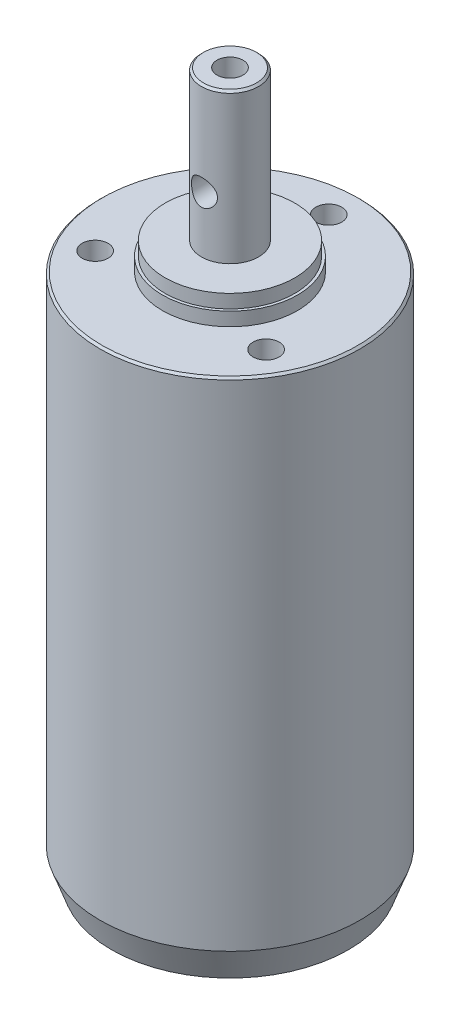
from build123d import *

# Parameters (mm, degrees)
CHAMFER_1_SIZE         = 0.2
CHAMFER_2_SIZE         = 3
CHAMFER_2_SIZE2        = 1.091910703
HOLE_WIZARD_M3_1_D     = 2.5
HOLE_WIZARD_M3_1_DEPTH = 5.5
HOLE_WIZARD_M3_1_TIP   = 0.751075774
HOLE_WIZARD_M3_2_D     = 2.5
HOLE_WIZARD_M3_2_DEPTH = 7.5
HOLE_WIZARD_M3_2_TIP   = 0.751075774
HOLE_WIZARD_M3_3_D     = 2.5
HOLE_WIZARD_M3_3_DEPTH = 4
HOLE_WIZARD_M3_3_TIP   = 0.751075774


with BuildPart() as part:
    # 草图1 → 旋转1 (revolve)
    with BuildSketch(Plane(origin=(0, 0, 0), x_dir=(0, 0, -1), z_dir=(1, 0, 0)), mode=Mode.PRIVATE) as revolve_1_sk:
        Polygon((0, 0), (2.75, 0), (2.75, 4), (12.5, 4), (12.5, 54.8), (6.5, 54.8), (6.5, 56.1), (6.238591707, 56.1), (6.238591707, 57.4), (2.75, 57.4), (2.75, 71.8), (0, 71.8), align=None)
    revolve(revolve_1_sk.sketch.rotate(Axis((0, 90.041930378, 0), (0, -1, 0)), 180), axis=Axis((0, 90.041930378, 0), (0, -1, 0)))

    # 倒角1
    chamfer_1_edges = [part.edges().sort_by_distance(p)[0] for p in [
        (0, 54.8, -12.5),
        (0, 0, -2.75),
        (0, 71.8, -2.75),
    ]]
    chamfer(chamfer_1_edges, length=CHAMFER_1_SIZE)

    # 倒角2
    chamfer_2_edges = [part.edges().sort_by_distance(p)[0] for p in [
        (0, 4, -12.5),
    ]]
    chamfer_2_side = [part.faces().sort_by_distance(p)[0] for p in [
        (0, 29.3, -12.5),
    ]]
    chamfer(chamfer_2_edges, length=CHAMFER_2_SIZE, length2=CHAMFER_2_SIZE2, reference=chamfer_2_side[0])

    # M3 螺纹孔1
    with Locations(Plane(origin=(0, 71.8, 0), x_dir=(1, 0, 0), z_dir=(0, 1, 0))):
        with Locations((0, 0)):
            Hole(HOLE_WIZARD_M3_1_D / 2, depth=HOLE_WIZARD_M3_1_DEPTH)
            with Locations((0, 0, -(HOLE_WIZARD_M3_1_DEPTH + HOLE_WIZARD_M3_1_TIP / 2))):  # 118° drill point
                Cone(0, HOLE_WIZARD_M3_1_D / 2, HOLE_WIZARD_M3_1_TIP, mode=Mode.SUBTRACT)

    # M3 螺纹孔2
    with Locations(Plane.XY.offset(2.75)):
        with Locations((0, 62.8)):
            Hole(HOLE_WIZARD_M3_2_D / 2, depth=HOLE_WIZARD_M3_2_DEPTH)
            with Locations((0, 0, -(HOLE_WIZARD_M3_2_DEPTH + HOLE_WIZARD_M3_2_TIP / 2))):  # 118° drill point
                Cone(0, HOLE_WIZARD_M3_2_D / 2, HOLE_WIZARD_M3_2_TIP, mode=Mode.SUBTRACT)

    # M3 螺纹孔3
    with Locations(Plane(origin=(0, 54.8, 0), x_dir=(1, 0, 0), z_dir=(0, 1, 0))):
        with Locations((0, 9.5), (-8.227241336, -4.75), (8.227241336, -4.75)):
            Hole(HOLE_WIZARD_M3_3_D / 2, depth=HOLE_WIZARD_M3_3_DEPTH)
            with Locations((0, 0, -(HOLE_WIZARD_M3_3_DEPTH + HOLE_WIZARD_M3_3_TIP / 2))):  # 118° drill point
                Cone(0, HOLE_WIZARD_M3_3_D / 2, HOLE_WIZARD_M3_3_TIP, mode=Mode.SUBTRACT)


solid = part.part
